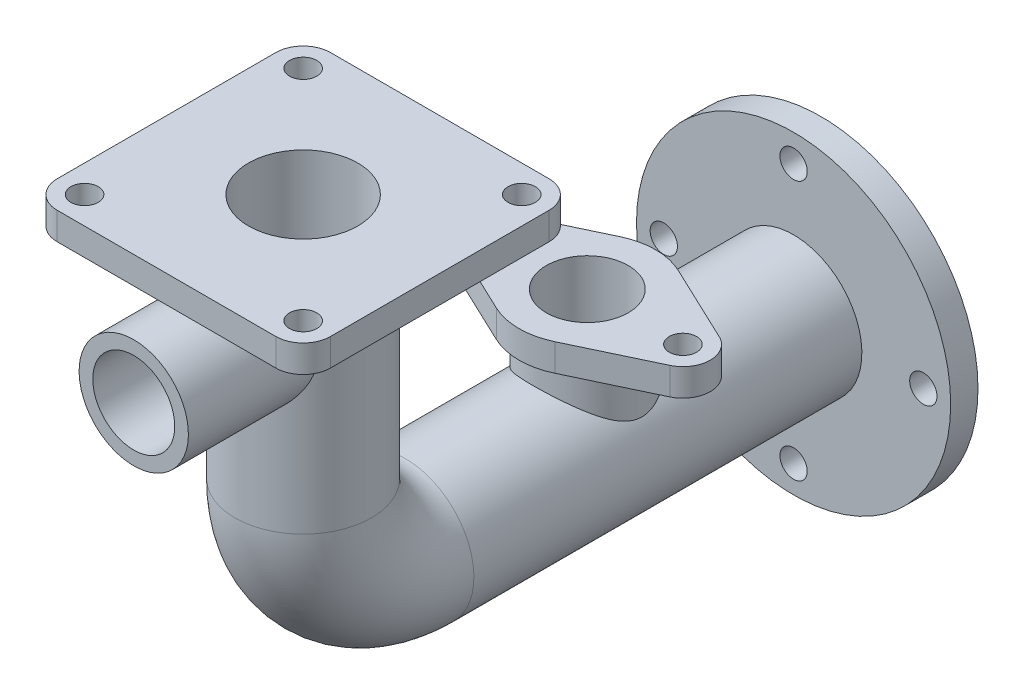
from build123d import *

# Parameters (mm, degrees)
SKETCH1_R                = 12.5
SKETCH1_R_2              = 10
BOSS_EXTRUDE1_START      = -5
SKETCH3_R                = 28.75
SKETCH3_R_2              = 10
BOSS_EXTRUDE1_DEPTH      = 5
HOLE1_D                  = 5
HOLE1_DEPTH              = 5
CIRPATTERN1_COUNT        = 4
SKETCH8_W                = 50
SKETCH8_H                = 50
SKETCH8_R                = 10
BOSS_EXTRUDE3_DEPTH      = 5
FILLET1_R                = 5
HOLE2_D                  = 5
SKETCH11_R               = 7.5
BOSS_EXTRUDE4_DEPTH      = 5
BOSS_EXTRUDE5_REACH      = 135.487
BOSS_EXTRUDE5_END_RADIUS = 12.5
SKETCH12_R               = 10
CUT_EXTRUDE1_REACH       = 135.487
CUT_EXTRUDE1_END_RADIUS  = 10
SKETCH15_R               = 7.5
HOLE4_D                  = 5
BOSS_EXTRUDE6_REACH      = 145.888
BOSS_EXTRUDE6_END_RADIUS = 12.5
SKETCH19_R               = 10
SKETCH19_R_2             = 7.5


with BuildPart() as part:
    # Sweep1: sweep along a path in Sketch2
    with BuildLine(Plane(origin=(0, 0, 0), x_dir=(0, 0, -1), z_dir=(1, 0, 0))) as sweep1_path:
        Line((0, 0), (-76, 0))
        ThreePointArc((-76, 0), (-89.258252147, 5.491747853), (-94.75, 18.75))
        Line((-94.75, 18.75), (-94.75, 63.75))
    # Sketch1 → Sweep1 (sweep)
    with BuildSketch(Plane.XY):
        Circle(SKETCH1_R)
        Circle(SKETCH1_R_2, mode=Mode.SUBTRACT)
    sweep(path=sweep1_path.line)

    # Sketch3 → Boss-Extrude1 (add)
    with BuildSketch(Plane(origin=(0, 0, 0), x_dir=(-1, 0, 0), z_dir=(0, 0, -1)).offset(BOSS_EXTRUDE1_START)):
        Circle(SKETCH3_R)
        with Locations(Location((0, 0, 0), (0, 0, 180))):
            Circle(SKETCH3_R_2, mode=Mode.SUBTRACT)
    extrude(amount=BOSS_EXTRUDE1_DEPTH)

    # Hole1
    with Locations(Plane.XY.offset(5)):
        with Locations((23.75, 0)):
            hole1 = Hole(HOLE1_D / 2, depth=HOLE1_DEPTH)

    # CirPattern1: Hole1 ×4 about axis
    cirpattern1_axis = Axis((0, 0, 0), (0, 0, 1))
    for i in range(1, CIRPATTERN1_COUNT):
        add(hole1.rotate(cirpattern1_axis, i * 360 / CIRPATTERN1_COUNT), mode=Mode.SUBTRACT)

    # Sketch8 → Boss-Extrude3 (add)
    with BuildSketch(Plane(origin=(0, 63.75, 0), x_dir=(1, 0, 0), z_dir=(0, 1, 0))):
        with Locations((0, -94.75)):
            Rectangle(SKETCH8_W, SKETCH8_H)
        with Locations(Location((0, -94.75, 0), (0, 0, 270))):
            Circle(SKETCH8_R, mode=Mode.SUBTRACT)
    extrude(amount=-BOSS_EXTRUDE3_DEPTH)

    # Fillet1
    fillet1_edges = [part.edges().sort_by_distance(p)[0] for p in [
        (25, 61.25, 69.75),
        (25, 61.25, 119.75),
        (-25, 61.25, 119.75),
        (-25, 61.25, 69.75),
    ]]
    fillet(fillet1_edges, radius=FILLET1_R)

    # Hole2 (through all)
    with Locations(Plane(origin=(0, 63.75, 0), x_dir=(1, 0, 0), z_dir=(0, 1, 0))):
        with Locations((20, -74.75), (-20, -74.75), (20, -114.75), (-20, -114.75)):
            Hole(HOLE2_D / 2)



with BuildPart() as body_2:
    # Sketch11 → Boss-Extrude4 (new body)
    with BuildSketch(Plane(origin=(0, 22.75, 0), x_dir=(1, 0, 0), z_dir=(0, 1, 0))):
        with BuildLine():
            Line((-19.642857143, -38.232460485), (-5.357142857, -31.456151214))
            ThreePointArc((-5.357142857, -31.456151214), (0, -30.25), (5.357142857, -31.456151214))
            Line((5.357142857, -31.456151214), (19.642857143, -38.232460485))
            ThreePointArc((19.642857143, -38.232460485), (22.5, -42.75), (19.642857143, -47.267539515))
            Line((19.642857143, -47.267539515), (5.357142857, -54.043848786))
            ThreePointArc((5.357142857, -54.043848786), (0, -55.25), (-5.357142857, -54.043848786))
            Line((-5.357142857, -54.043848786), (-19.642857143, -47.267539515))
            ThreePointArc((-19.642857143, -47.267539515), (-22.5, -42.75), (-19.642857143, -38.232460485))
        make_face()
        with Locations(Location((0, -42.75, 0), (0, 0, 270))):
            Circle(SKETCH11_R, mode=Mode.SUBTRACT)
    extrude(amount=-BOSS_EXTRUDE4_DEPTH)


with BuildPart() as part_1:
    add(part.part)

    add(body_2.part)  # Boss-Extrude5 merges body 2
    # Boss-Extrude5: up to this cylinder (the profile starts outside it)
    boss_extrude5_end = Plane(origin=(0, 0, 42.75), z_dir=(0, 0, 1)) * Cylinder(BOSS_EXTRUDE5_END_RADIUS, 296.974, mode=Mode.PRIVATE)
    # Sketch12 → Boss-Extrude5 (add, up to the surface)
    with BuildSketch(Plane(origin=(0, 22.75, 0), x_dir=(1, 0, 0), z_dir=(0, 1, 0)), mode=Mode.PRIVATE) as boss_extrude5_sk1:
        with Locations(Location((0, -42.75, 0), (0, 0, 270))):
            Circle(SKETCH12_R)
    boss_extrude5_tool1 = extrude(boss_extrude5_sk1.sketch, amount=-BOSS_EXTRUDE5_REACH, mode=Mode.PRIVATE) - boss_extrude5_end
    add(boss_extrude5_tool1.solids().sort_by_distance((0, 22.75, 42.75))[0])

    # Cut-Extrude1: up to this cylinder (the profile starts outside it)
    cut_extrude1_end = Plane(origin=(0, 0, 42.75), z_dir=(0, 0, 1)) * Cylinder(CUT_EXTRUDE1_END_RADIUS, 291.974, mode=Mode.PRIVATE)
    # Sketch15 → Cut-Extrude1 (cut, up to the surface)
    with BuildSketch(Plane(origin=(0, 22.75, 0), x_dir=(1, 0, 0), z_dir=(0, 1, 0)), mode=Mode.PRIVATE) as cut_extrude1_sk1:
        with Locations(Location((0, -42.75, 0), (0, 0, 270))):
            Circle(SKETCH15_R)
    cut_extrude1_tool1 = extrude(cut_extrude1_sk1.sketch, amount=-CUT_EXTRUDE1_REACH, mode=Mode.PRIVATE) - cut_extrude1_end
    add(cut_extrude1_tool1.solids().sort_by_distance((0, 22.75, 42.75))[0], mode=Mode.SUBTRACT)

    # Hole4 (through all)
    with Locations(Plane(origin=(0, 22.75, 0), x_dir=(1, 0, 0), z_dir=(0, 1, 0))):
        with Locations((17.5, -42.75), (-17.5, -42.75)):
            Hole(HOLE4_D / 2)

    # Boss-Extrude6: up to this cylinder (the profile starts outside it)
    boss_extrude6_end = Plane(origin=(0, 36.532843, 94.75), z_dir=(0, 1, 0)) * Cylinder(BOSS_EXTRUDE6_END_RADIUS, 317.776, mode=Mode.PRIVATE)
    # Sketch19 → Boss-Extrude6 (add, up to the surface)
    with BuildSketch(Plane(origin=(0, 0, 125.75), x_dir=(-1, 0, 0), z_dir=(0, 0, -1)), mode=Mode.PRIVATE) as boss_extrude6_sk1:
        with Locations(Location((0, 46.25, 0), (0, 0, 90))):
            Circle(SKETCH19_R)
        with Locations(Location((0, 46.25, 0), (0, 0, 270))):
            Circle(SKETCH19_R_2, mode=Mode.SUBTRACT)
    boss_extrude6_tool1 = extrude(boss_extrude6_sk1.sketch, amount=BOSS_EXTRUDE6_REACH, mode=Mode.PRIVATE) - boss_extrude6_end
    add(boss_extrude6_tool1.solids().sort_by_distance((0, 36.532843, 125.75))[0])


solid = part_1.part
